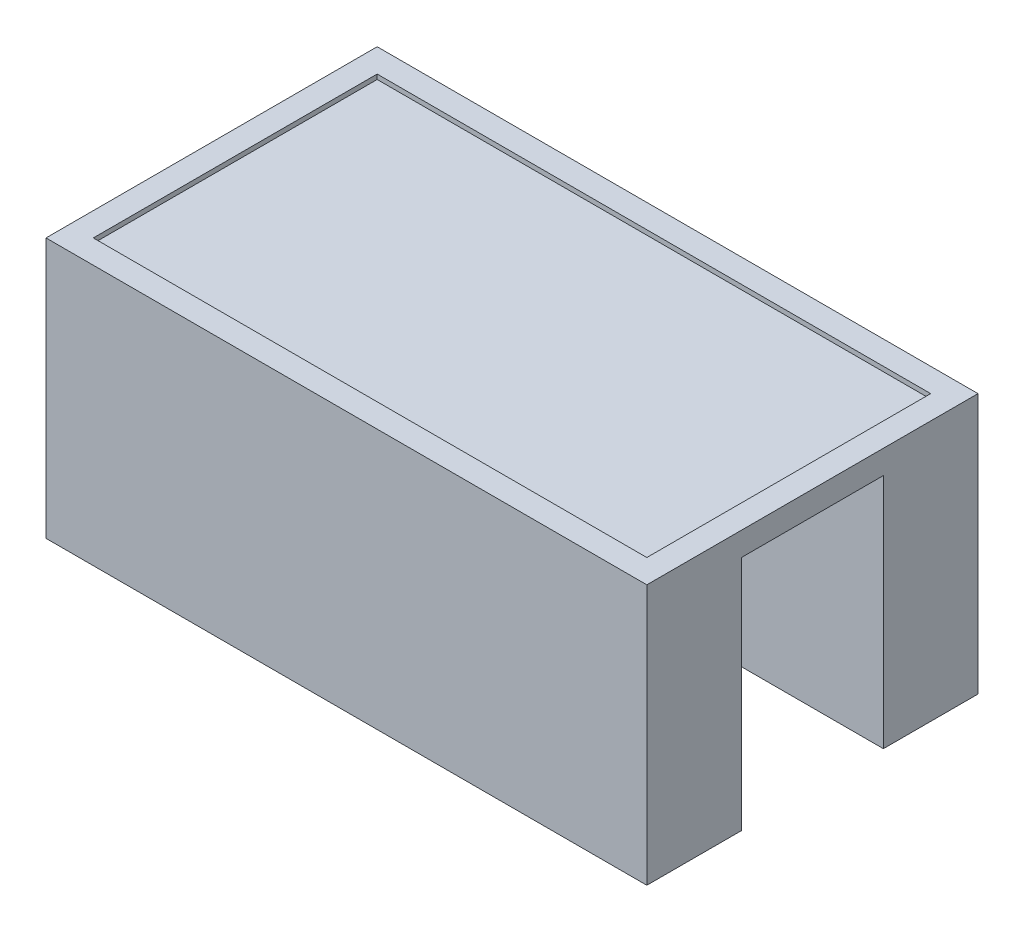
from build123d import *

# Parameters (mm, degrees)
SKETCH2_W           = 127
SKETCH2_H           = 70
BOSS_EXTRUDE1_DEPTH = 55
SKETCH4_W           = 127
SKETCH4_H           = 30
CUT_EXTRUDE1_DEPTH  = 50
SKETCH5_W           = 15
SKETCH5_H           = 23
BOSS_EXTRUDE2_DEPTH = 23
SKETCH6_W           = 3
SKETCH6_H           = 23
CUT_EXTRUDE2_DEPTH  = 23
SKETCH9_W           = 15
SKETCH9_H           = 10
CUT_EXTRUDE3_DEPTH  = 11.5
SKETCH10_W          = 117
SKETCH10_H          = 60
CUT_EXTRUDE4_DEPTH  = 1
SKETCH12_R          = 5
CUT_EXTRUDE5_DEPTH  = 300


with BuildPart() as part:
    # Sketch2 → Boss-Extrude1 (new body)
    with BuildSketch(Plane(origin=(0, 0, 0), x_dir=(1, 0, 0), z_dir=(0, 1, 0))):
        Rectangle(SKETCH2_W, SKETCH2_H)
    extrude(amount=BOSS_EXTRUDE1_DEPTH)

    # Sketch4 → Cut-Extrude1 (cut)
    with BuildSketch(Plane(origin=(0, 0, 0), x_dir=(1, 0, 0), z_dir=(0, 1, 0))):
        Rectangle(SKETCH4_W, SKETCH4_H)
    extrude(amount=CUT_EXTRUDE1_DEPTH, mode=Mode.SUBTRACT)

    # Sketch5 → Boss-Extrude2 (add)
    with BuildSketch(Plane.XZ.offset(-50)):
        Rectangle(SKETCH5_W, SKETCH5_H)
    extrude(amount=BOSS_EXTRUDE2_DEPTH)

    # Sketch6 → Cut-Extrude2 (cut)
    with BuildSketch(Plane.XZ.offset(-27)):
        with Locations((5, 0)):
            Rectangle(SKETCH6_W, SKETCH6_H)
    extrude(amount=-CUT_EXTRUDE2_DEPTH, mode=Mode.SUBTRACT)

    # Sketch9 → Cut-Extrude3 (cut)
    with BuildSketch(Plane(origin=(0, 27, 0), x_dir=(1, 0, 0), z_dir=(0, 1, 0))):
        Rectangle(SKETCH9_W, SKETCH9_H)
    extrude(amount=CUT_EXTRUDE3_DEPTH, mode=Mode.SUBTRACT)

    # Sketch10 → Cut-Extrude4 (cut)
    with BuildSketch(Plane(origin=(0, 55, 0), x_dir=(1, 0, 0), z_dir=(0, 1, 0))):
        Rectangle(SKETCH10_W, SKETCH10_H)
    extrude(amount=-CUT_EXTRUDE4_DEPTH, mode=Mode.SUBTRACT)

    # Sketch12 → Cut-Extrude5 (cut)
    with BuildSketch(Plane.ZY.offset(7.5)):
        with Locations((0, 38.5)):
            Circle(SKETCH12_R)
    extrude(amount=-CUT_EXTRUDE5_DEPTH, mode=Mode.SUBTRACT)


solid = part.part
